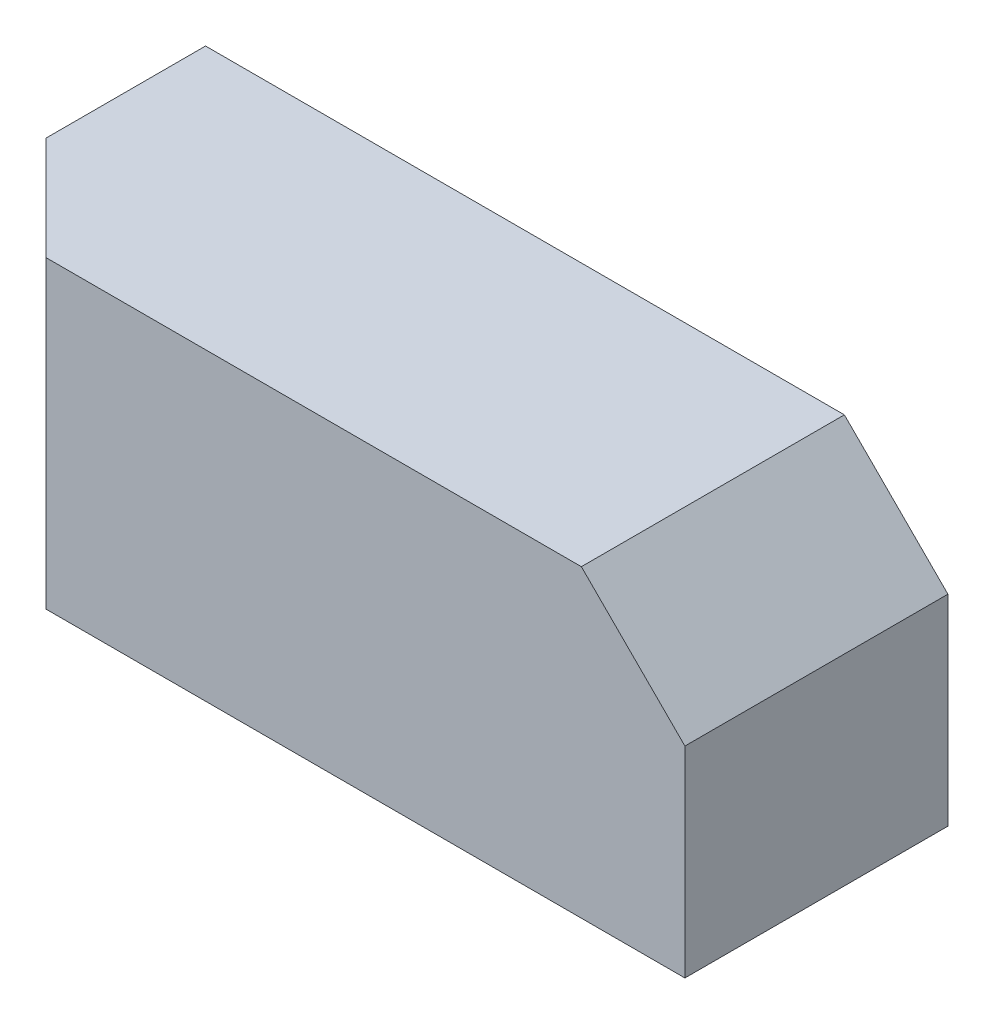
from build123d import *

# Parameters (mm, degrees)
SKETCH1_W           = 71.695166663
SKETCH1_H           = 39.401169853
BOSS_EXTRUDE1_DEPTH = 25.4
CHAMFER1_SIZE       = 10
SCALE1_SCALE        = 0.5


with BuildPart() as part:
    # Sketch1 → Boss-Extrude1 (new body)
    with BuildSketch(Plane.XY):
        with Locations((35.847583332, 19.700584926)):
            Rectangle(SKETCH1_W, SKETCH1_H)
    extrude(amount=BOSS_EXTRUDE1_DEPTH)

    # Chamfer1
    chamfer1_edges = [part.edges().sort_by_distance(p)[0] for p in [
        (0, 19.700584926, 25.4),
        (35.847583331, 0, 0),
        (71.695166663, 39.401169853, 12.7),
        (71.695166663, 0, 12.7),
        (0, 0, 12.7),
        (35.847583331, 0, 25.4),
    ]]
    chamfer(chamfer1_edges, length=CHAMFER1_SIZE)


with BuildPart() as part_1:
    # Scale1: scaled about (36.040178536, 21.517729934, 12.451063985)
    add(part.part.scale(SCALE1_SCALE).moved(Location((18.020089268, 10.758864967, 6.225531992))))


solid = part_1.part
